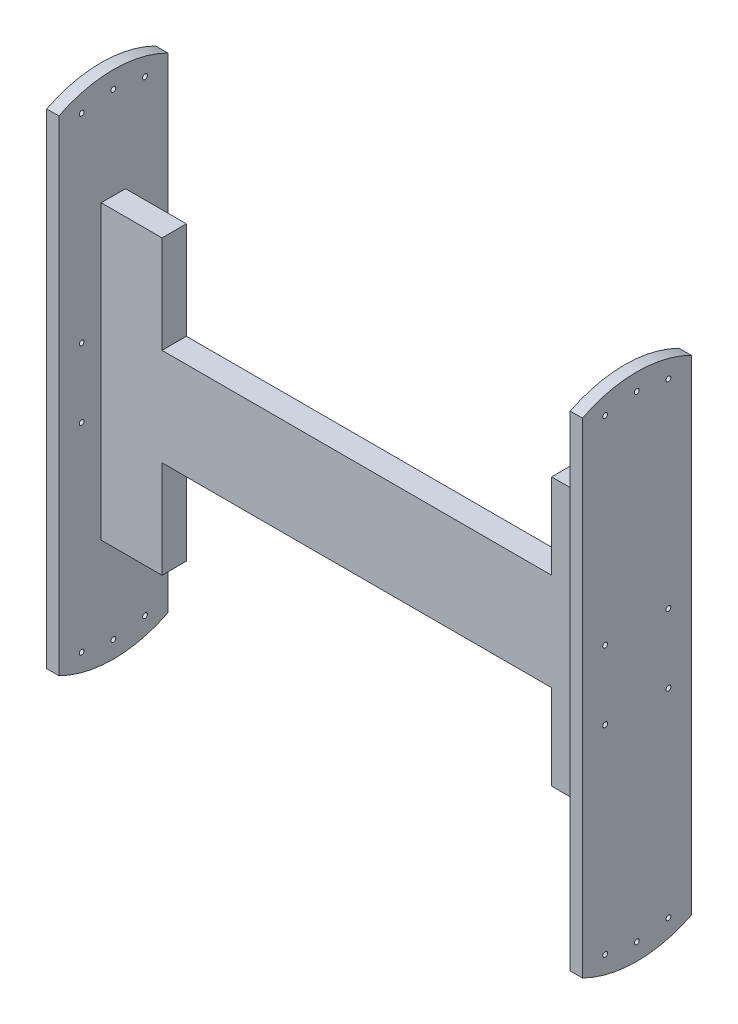
from build123d import *

# Parameters (mm, degrees)
SKETCH_1_W          = 220
SKETCH_1_H          = 120
EXTRUDE_1_DEPTH     = 10
CUT_EXTRUDE_1_DEPTH = 10
SKETCH_5_R          = 1
SKETCH_5_W          = 10
SKETCH_5_H          = 110
EXTRUDE_2_DEPTH     = 5


with BuildPart() as part:
    # 草图1 → 凸台-拉伸1 (new body)
    with BuildSketch(Plane.XY):
        with Locations((110, 60)):
            Rectangle(SKETCH_1_W, SKETCH_1_H)
    extrude(amount=EXTRUDE_1_DEPTH)

    # 草图2 → 切除-拉伸1 (cut)
    with BuildSketch(Plane.XY.offset(10)):
        Polygon((220, 120), (30, 120), (30, 80), (190, 80), (190, 115), (220, 115), align=None)
        Polygon((220, 0), (220, 5), (190, 5), (190, 40), (30, 40), (30, 0), align=None)
    extrude(amount=-CUT_EXTRUDE_1_DEPTH, mode=Mode.SUBTRACT)

    # 草图5 → 凸台-拉伸2 (add)
    # profile 1 of 3: a face of its own
    with BuildSketch(Plane(origin=(220, 0, 0), x_dir=(0, 0, -1), z_dir=(1, 0, 0))):
        with BuildLine():
            Line((-27.365, 70.42619968), (-27.365, 159.57380032))
            ThreePointArc((-27.365, 159.57380032), (-5, 164.87), (17.365, 159.57380032))
            Line((17.365, 159.57380032), (17.365, 70.42619968))
            Line((17.365, 70.42619968), (17.365, 49.57380032))
            Line((17.365, 49.57380032), (17.365, -39.57380032))
            ThreePointArc((17.365, -39.57380032), (-5, -44.87), (-27.365, -39.57380032))
            Line((-27.365, -39.57380032), (-27.365, 49.57380032))
            Line((-27.365, 49.57380032), (-27.365, 70.42619968))
        make_face()
        with Locations((-5, 157.87)):
            Circle(SKETCH_5_R, mode=Mode.SUBTRACT)
        with Locations((-18, 155.851400221)):
            Circle(SKETCH_5_R, mode=Mode.SUBTRACT)
        with Locations((8, 155.851400221)):
            Circle(SKETCH_5_R, mode=Mode.SUBTRACT)
        with Locations((8, 74.148599779)):
            Circle(SKETCH_5_R, mode=Mode.SUBTRACT)
        with Locations((-18, 74.148599779)):
            Circle(SKETCH_5_R, mode=Mode.SUBTRACT)
        with Locations((-18, 45.851400221)):
            Circle(SKETCH_5_R, mode=Mode.SUBTRACT)
        with Locations((8, 45.851400221)):
            Circle(SKETCH_5_R, mode=Mode.SUBTRACT)
        with Locations((8, -35.851400221)):
            Circle(SKETCH_5_R, mode=Mode.SUBTRACT)
        with Locations((-18, -35.851400221)):
            Circle(SKETCH_5_R, mode=Mode.SUBTRACT)
        with Locations((-5, -37.87)):
            Circle(SKETCH_5_R, mode=Mode.SUBTRACT)
        with Locations((-5, 60)):
            Rectangle(SKETCH_5_W, SKETCH_5_H, mode=Mode.SUBTRACT)
    # profile 2 of 3: a face of its own
    with BuildSketch(Plane(origin=(220, 0, 0), x_dir=(0, 0, -1), z_dir=(1, 0, 0))):
        with Locations((-5, 47.87)):
            Circle(SKETCH_5_R)
    # profile 3 of 3: a face of its own
    with BuildSketch(Plane(origin=(220, 0, 0), x_dir=(0, 0, -1), z_dir=(1, 0, 0))):
        with Locations((-5, 72.13)):
            Circle(SKETCH_5_R)
    extrude_2 = extrude(amount=-EXTRUDE_2_DEPTH)

    # 镜向1: 凸台-拉伸2 across plane
    add(extrude_2.mirror(Plane(origin=(110, 0, 0), x_dir=(0, 0, 1), z_dir=(1, 0, 0))))


solid = part.part
